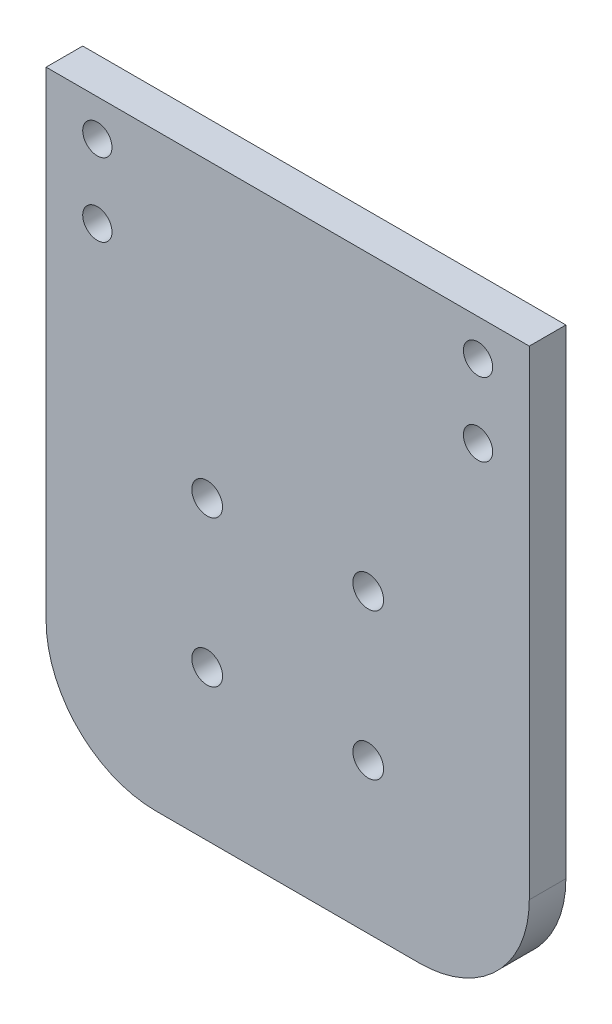
from build123d import *

# Parameters (mm, degrees)
SKETCH_1_W          = 66
SKETCH_1_H          = 80.5
EXTRUDE_1_DEPTH     = 5
SKETCH_2_R          = 2
CUT_EXTRUDE_1_DEPTH = 53.288263501
SKETCH_3_R          = 2.1
CUT_EXTRUDE_2_DEPTH = 10
FILLET_1_R          = 15


with BuildPart() as part:
    # 草图1 → 凸台-拉伸1 (new body)
    with BuildSketch(Plane.XY):
        Rectangle(SKETCH_1_W, SKETCH_1_H)
    extrude(amount=EXTRUDE_1_DEPTH)

    # 草图2 → 切除-拉伸1 (cut, through all)
    with BuildSketch(Plane.XY.offset(5)):
        with Locations((-26, 35.25)):
            Circle(SKETCH_2_R)
        with Locations((26, 35.25)):
            Circle(SKETCH_2_R)
        with Locations((26, 25.25)):
            Circle(SKETCH_2_R)
        with Locations((-26, 25.25)):
            Circle(SKETCH_2_R)
    extrude(amount=-CUT_EXTRUDE_1_DEPTH, mode=Mode.SUBTRACT)

    # 草图3 → 切除-拉伸2 (cut)
    with BuildSketch(Plane.XY.offset(5)):
        with Locations((-11, 0.25)):
            Circle(SKETCH_3_R)
        with Locations((11, 0.25)):
            Circle(SKETCH_3_R)
        with Locations((11, -19.75)):
            Circle(SKETCH_3_R)
        with Locations((-11, -19.75)):
            Circle(SKETCH_3_R)
    extrude(amount=-CUT_EXTRUDE_2_DEPTH, mode=Mode.SUBTRACT)

    # 圆角1
    fillet_1_edges = [part.edges().sort_by_distance(p)[0] for p in [
        (33, -40.25, 2.5),
        (-33, -40.25, 2.5),
    ]]
    fillet(fillet_1_edges, radius=FILLET_1_R)


solid = part.part
